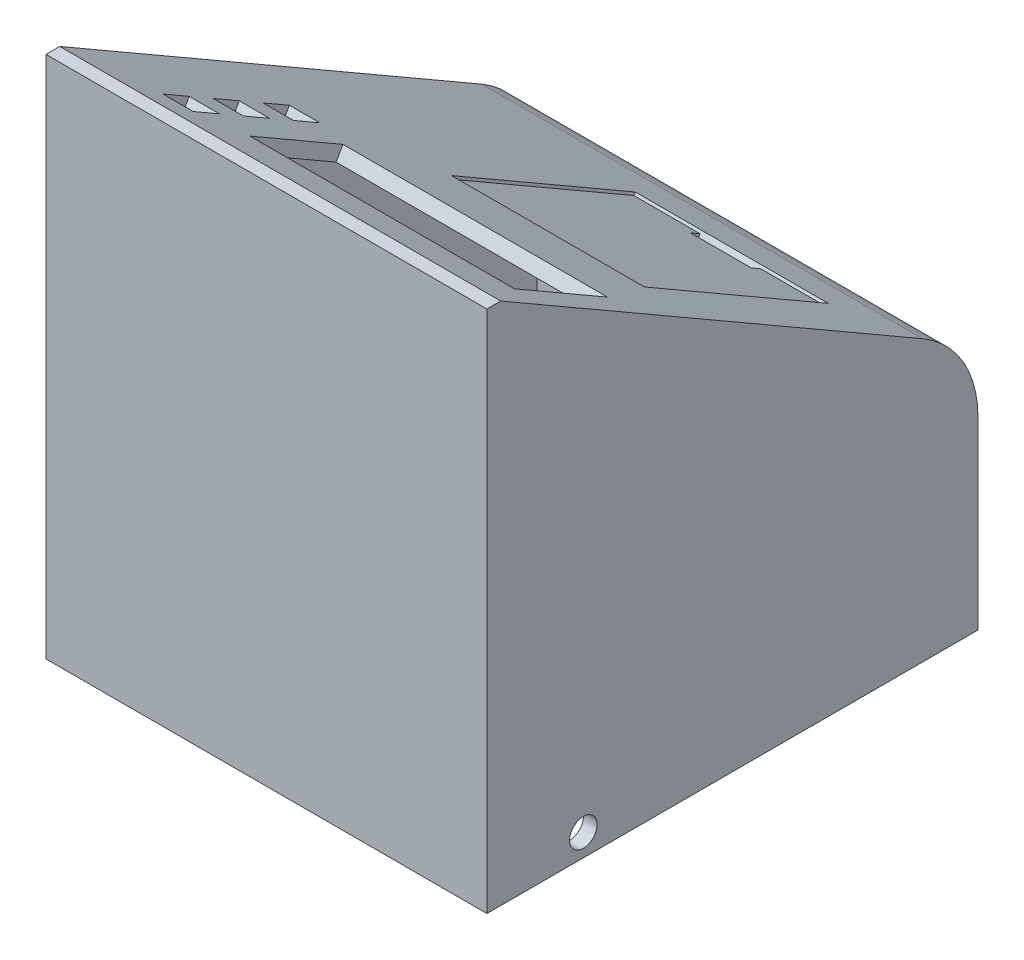
from build123d import *

# Parameters (mm, degrees)
BOSS_EXTRUDE1_DEPTH  = 5
SKETCH2_W            = 160
SKETCH2_H            = 200
BOSS_EXTRUDE2_DEPTH  = 5
SKETCH4_W            = 160
SKETCH4_H            = 190
BOSS_EXTRUDE4_DEPTH  = 5
SKETCH5_W            = 160
SKETCH5_H            = 90
BOSS_EXTRUDE5_DEPTH  = 5
SKETCH6_W            = 96
SKETCH6_H            = 39
SKETCH6_W_2          = 11
SKETCH6_H_2          = 11
CUT_EXTRUDE2_DEPTH   = 5
FILLET1_R            = 40
SKETCH7_W            = 70
SKETCH7_H            = 77
CUT_EXTRUDE3_DEPTH   = 1
SKETCH8_W            = 22
SKETCH8_H            = 4
CUT_EXTRUDE4_DEPTH   = 4
SKETCH9_W            = 40
SKETCH9_H            = 60
CUT_EXTRUDE5_DEPTH   = 5
SKETCH12_W           = 40
SKETCH12_H           = 60
BOSS_EXTRUDE6_DEPTH  = 2
SKETCH14_W           = 77
SKETCH14_H           = 53
CUT_EXTRUDE6_DEPTH   = 5
SKETCH15_W           = 3
SKETCH15_H           = 29
CUT_EXTRUDE7_DEPTH   = 5
SKETCH17_R           = 1.75
CUT_EXTRUDE9_DEPTH   = 4
SKETCH21_R           = 1.5
BOSS_EXTRUDE8_DEPTH  = 4
SKETCH23_R           = 1.5
BOSS_EXTRUDE9_DEPTH  = 10
SKETCH25_R           = 1.5
BOSS_EXTRUDE10_DEPTH = 10
SKETCH33_R           = 5
CUT_EXTRUDE14_DEPTH  = 10


with BuildPart() as part:
    # Sketch1 → Boss-Extrude1 (new body)
    with BuildSketch(Plane(origin=(0, 0, 0), x_dir=(0, 0, -1), z_dir=(1, 0, 0))):
        Polygon((0, 0), (173.205080757, -100), (173.205080757, -190), (0, -190), align=None)
    boss_extrude1 = extrude(amount=BOSS_EXTRUDE1_DEPTH)

    # Sketch2 → Boss-Extrude2 (add)
    with BuildSketch(Plane(origin=(0, 0, 0), x_dir=(1, 0, 0), z_dir=(0, 0.8660254037844382, -0.5000000000000011))):
        with Locations((80, 100)):
            Rectangle(SKETCH2_W, SKETCH2_H)
    extrude(amount=-BOSS_EXTRUDE2_DEPTH)

    # Sketch4 → Boss-Extrude4 (add)
    with BuildSketch(Plane.XY):
        with Locations((80, -95)):
            Rectangle(SKETCH4_W, SKETCH4_H)
    extrude(amount=BOSS_EXTRUDE4_DEPTH)

    # Sketch5 → Boss-Extrude5 (add)
    with BuildSketch(Plane(origin=(0, 0, -173.205080757), x_dir=(-1, 0, 0), z_dir=(0, 0, -1))):
        with Locations((-80, -145)):
            Rectangle(SKETCH5_W, SKETCH5_H)
    extrude(amount=-BOSS_EXTRUDE5_DEPTH)

    # Mirror1: Boss-Extrude1 across plane
    add(boss_extrude1.mirror(Plane.ZY.offset(-80)))

    # Sketch6 → Cut-Extrude2 (cut)
    with BuildSketch(Plane(origin=(0, 0, 0), x_dir=(1, 0, 0), z_dir=(0, 0.8660254037844382, -0.5000000000000011))):
        with Locations((102, 36.815172727)):
            Rectangle(SKETCH6_W, SKETCH6_H)
        with Locations((34, 15.815172727)):
            Rectangle(SKETCH6_W_2, SKETCH6_H_2)
        with Locations((34, 36.815172727)):
            Rectangle(SKETCH6_W_2, SKETCH6_H_2)
        with Locations((34, 57.815172727)):
            Rectangle(SKETCH6_W_2, SKETCH6_H_2)
    extrude(amount=-CUT_EXTRUDE2_DEPTH, mode=Mode.SUBTRACT)

    # Fillet1
    fillet1_edges = [part.edges().sort_by_distance(p)[0] for p in [
        (80, -100, -173.205080757),
    ]]
    fillet(fillet1_edges, radius=FILLET1_R)

    # Sketch7 → Cut-Extrude3 (cut)
    with BuildSketch(Plane(origin=(0, 0, 0), x_dir=(1, 0, 0), z_dir=(0, 0.8660254037844382, -0.5000000000000011))):
        with Locations((105, 121.815172727)):
            Rectangle(SKETCH7_W, SKETCH7_H)
    extrude(amount=-CUT_EXTRUDE3_DEPTH, mode=Mode.SUBTRACT)

    # Sketch8 → Cut-Extrude4 (cut)
    with BuildSketch(Plane(origin=(0, -0.866025403784426, 0.4999999999999943), x_dir=(1, 0, 0), z_dir=(0, 0.8660254037844382, -0.5000000000000011))):
        with Locations((105, 158.315172727)):
            Rectangle(SKETCH8_W, SKETCH8_H)
    extrude(amount=-CUT_EXTRUDE4_DEPTH, mode=Mode.SUBTRACT)

    # Sketch9 → Cut-Extrude5 (cut)
    with BuildSketch(Plane(origin=(0, 0, 0), x_dir=(1, 0, 0), z_dir=(0, 0.8660254037844382, -0.5000000000000011))):
        with Locations((35, 121.815172727)):
            Rectangle(SKETCH9_W, SKETCH9_H)
    extrude(amount=-CUT_EXTRUDE5_DEPTH, mode=Mode.SUBTRACT)

    # Sketch12 → Boss-Extrude6 (add)
    with BuildSketch(Plane(origin=(0, 0, 0), x_dir=(1, 0, 0), z_dir=(0, 0.8660254037844382, -0.5000000000000011))):
        with Locations((35, 121.815172727)):
            Rectangle(SKETCH12_W, SKETCH12_H)
    extrude(amount=-BOSS_EXTRUDE6_DEPTH)

    # Sketch14 → Cut-Extrude6 (cut)
    with BuildSketch(Plane(origin=(0, 0, -173.205080757), x_dir=(-1, 0, 0), z_dir=(0, 0, -1))):
        with Locations((-101.5, -156.594010768)):
            Rectangle(SKETCH14_W, SKETCH14_H)
    extrude(amount=-CUT_EXTRUDE6_DEPTH, mode=Mode.SUBTRACT)

    # Sketch15 → Cut-Extrude7 (cut)
    with BuildSketch(Plane(origin=(0, 0, -173.205080757), x_dir=(-1, 0, 0), z_dir=(0, 0, -1))):
        with Locations((-61.5, -156.594010768)):
            Rectangle(SKETCH15_W, SKETCH15_H)
        with Locations((-141.5, -156.594010768)):
            Rectangle(SKETCH15_W, SKETCH15_H)
    extrude(amount=-CUT_EXTRUDE7_DEPTH, mode=Mode.SUBTRACT)

    # Sketch17 → Cut-Extrude9 (cut)
    with BuildSketch(Plane(origin=(0, -4.330127019, 2.5), x_dir=(-1, 0, 0), z_dir=(0, -0.8660254037844382, 0.500000000000001))):
        with Locations(Location((-54.75, 64.989476433, 0), (0, 0, 90))):
            Circle(SKETCH17_R)
        with Locations(Location((-149.25, 64.989476433, 0), (0, 0, 270))):
            Circle(SKETCH17_R)
        with Locations(Location((-54.75, 8.489476433, 0), (0, 0, 270))):
            Circle(SKETCH17_R)
        with Locations(Location((-149.25, 8.489476433, 0), (0, 0, 90))):
            Circle(SKETCH17_R)
    extrude(amount=-CUT_EXTRUDE9_DEPTH, mode=Mode.SUBTRACT)

    # Sketch21 → Boss-Extrude8 (add)
    with BuildSketch(Plane(origin=(0, -1.732050808, 1), x_dir=(-1, 0, 0), z_dir=(0, -0.8660254037844382, 0.500000000000001))):
        with Locations(Location((-48.5, 98.315172727, 0), (0, 0, 270))):
            Circle(SKETCH21_R)
        with Locations(Location((-21.5, 97.315172727, 0), (0, 0, 270))):
            Circle(SKETCH21_R)
        with Locations(Location((-17.5, 136.315172727, 0), (0, 0, 270))):
            Circle(SKETCH21_R)
        with Locations(Location((-52.5, 136.315172727, 0), (0, 0, 270))):
            Circle(SKETCH21_R)
    extrude(amount=BOSS_EXTRUDE8_DEPTH)

    # Sketch23 → Boss-Extrude9 (add)
    with BuildSketch(Plane(origin=(0, -190, 0), x_dir=(-1, 0, 0), z_dir=(0, -1, 0))):
        with BuildLine():
            Line((-155, 0), (-145, 0))
            ThreePointArc((-145, 0), (-147.928932188, 7.071067812), (-155, 10))
            Line((-155, 10), (-155, 0))
        make_face()
        with Locations(Location((-151.751738587, 3.801157428, 0), (0, 0, 90))):
            Circle(SKETCH23_R, mode=Mode.SUBTRACT)
    boss_extrude9 = extrude(amount=-BOSS_EXTRUDE9_DEPTH)

    # Mirror2: Boss-Extrude9 across plane
    add(boss_extrude9.mirror(Plane.ZY.offset(-80)))

    # Sketch25 → Boss-Extrude10 (add)
    with BuildSketch(Plane(origin=(0, -190, 0), x_dir=(-1, 0, 0), z_dir=(0, -1, 0))):
        with BuildLine():
            Line((-155, 168.205080757), (-145, 168.205080757))
            ThreePointArc((-145, 168.205080757), (-147.928932188, 161.134012945), (-155, 158.205080757))
            Line((-155, 158.205080757), (-155, 168.205080757))
        make_face()
        with Locations(Location((-151.620258089, 164.520335906, 0), (0, 0, 90))):
            Circle(SKETCH25_R, mode=Mode.SUBTRACT)
    boss_extrude10 = extrude(amount=-BOSS_EXTRUDE10_DEPTH)

    # Mirror4: Boss-Extrude10 across plane
    add(boss_extrude10.mirror(Plane.ZY.offset(-80)))

    # Sketch33 → Cut-Extrude14 (cut)
    with BuildSketch(Plane(origin=(160, 0, 0), x_dir=(0, 0, -1), z_dir=(1, 0, 0))):
        with Locations((30, -182)):
            Circle(SKETCH33_R)
    extrude(amount=-CUT_EXTRUDE14_DEPTH, mode=Mode.SUBTRACT)


solid = part.part
